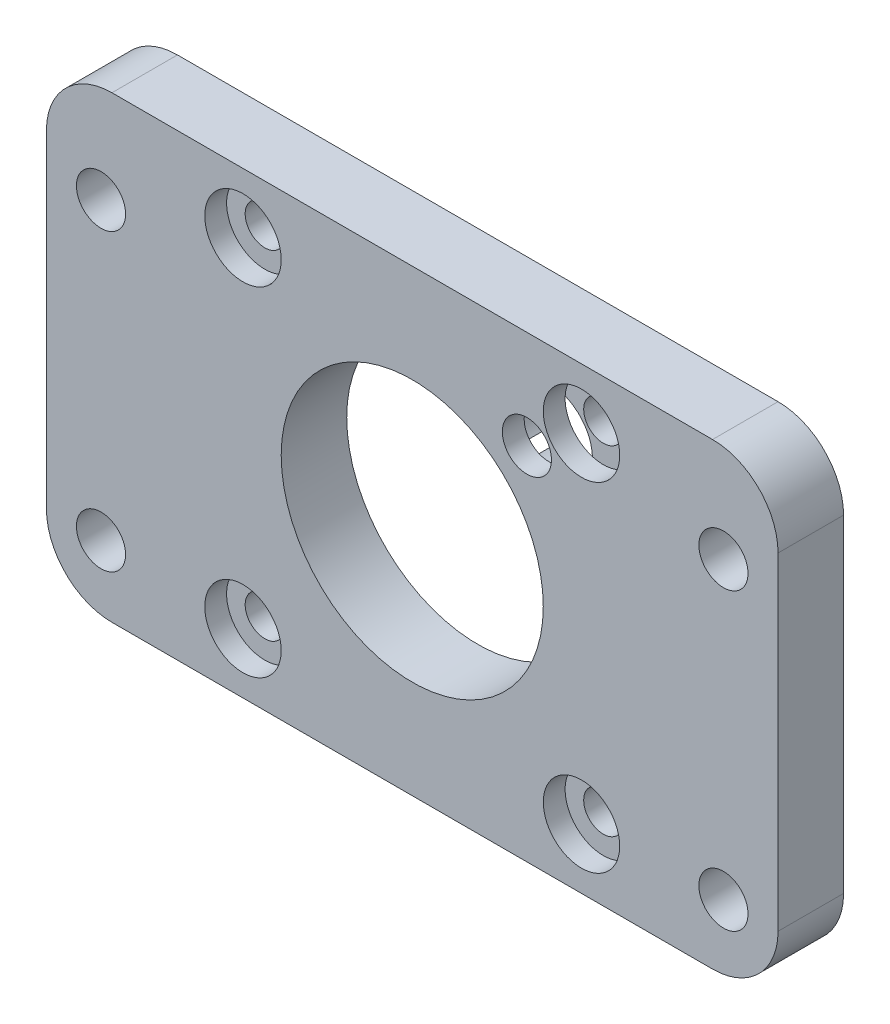
from build123d import *

# Parameters (mm, degrees)
SKETCH_1_W          = 67
SKETCH_1_H          = 42
EXTRUDE_1_DEPTH     = 6
SKETCH_2_R          = 2.25
CUT_EXTRUDE_1_DEPTH = 9
FILLET_1_R          = 6
SKETCH_3_R          = 12
SKETCH_3_R_2        = 1.8
CUT_EXTRUDE_2_DEPTH = 10
SKETCH_4_R          = 3.5
CUT_EXTRUDE_3_DEPTH = 2
SKETCH_8_R          = 4
SKETCH_8_R_2        = 2.25
CUT_EXTRUDE_6_DEPTH = 4
SKETCH_8_2_R        = 2.25
CUT_EXTRUDE_7_DEPTH = 26


with BuildPart() as part:
    # Эскиз1 → Бобышка-Вытянуть1 (new body)
    with BuildSketch(Plane.XY):
        with Locations((33.5, 21)):
            Rectangle(SKETCH_1_W, SKETCH_1_H)
    extrude(amount=EXTRUDE_1_DEPTH)

    # Эскиз2 → Вырез-Вытянуть1 (cut)
    with BuildSketch(Plane(origin=(0, 0, 0), x_dir=(-1, 0, 0), z_dir=(0, 0, -1))):
        with Locations((-62, 6)):
            Circle(SKETCH_2_R)
        with Locations((-62, 33)):
            Circle(SKETCH_2_R)
        with Locations((-5, 6)):
            Circle(SKETCH_2_R)
        with Locations((-5, 33)):
            Circle(SKETCH_2_R)
    extrude(amount=-CUT_EXTRUDE_1_DEPTH, mode=Mode.SUBTRACT)

    # Скругление1
    fillet_1_edges = [part.edges().sort_by_distance(p)[0] for p in [
        (0, 0, 3),
        (0, 42, 3),
        (67, 0, 3),
        (67, 42, 3),
    ]]
    fillet(fillet_1_edges, radius=FILLET_1_R)

    # Эскиз3 → Вырез-Вытянуть2 (cut)
    with BuildSketch(Plane(origin=(0, 0, 0), x_dir=(-1, 0, 0), z_dir=(0, 0, -1))):
        with Locations((-33.5, 21)):
            Circle(SKETCH_3_R)
        with Locations((-18, 36.5)):
            Circle(SKETCH_3_R_2)
        with Locations((-18, 5.5)):
            Circle(SKETCH_3_R_2)
        with Locations((-49, 5.5)):
            Circle(SKETCH_3_R_2)
        with Locations((-49, 36.5)):
            Circle(SKETCH_3_R_2)
    extrude(amount=-CUT_EXTRUDE_2_DEPTH, mode=Mode.SUBTRACT)

    # Эскиз4 → Вырез-Вытянуть3 (cut)
    with BuildSketch(Plane.XY.offset(6)):
        with Locations((18, 5.5)):
            Circle(SKETCH_4_R)
        with Locations((18, 36.5)):
            Circle(SKETCH_4_R)
        with Locations((49, 5.5)):
            Circle(SKETCH_4_R)
        with Locations((49, 36.5)):
            Circle(SKETCH_4_R)
    extrude(amount=-CUT_EXTRUDE_3_DEPTH, mode=Mode.SUBTRACT)

    # Эскиз8 → Вырез-Вытянуть6 (cut)
    with BuildSketch(Plane(origin=(0, 0, 0), x_dir=(-1, 0, 0), z_dir=(0, 0, -1))):
        with Locations((-44, 33)):
            Circle(SKETCH_8_R)
        with Locations((-44, 33)):
            Circle(SKETCH_8_R_2, mode=Mode.SUBTRACT)
    extrude(amount=-CUT_EXTRUDE_6_DEPTH, mode=Mode.SUBTRACT)

    # Эскиз8<2> → Вырез-Вытянуть7 (cut)
    with BuildSketch(Plane(origin=(0, 0, 0), x_dir=(-1, 0, 0), z_dir=(0, 0, -1))):
        with Locations((-44, 33)):
            Circle(SKETCH_8_2_R)
    extrude(amount=-CUT_EXTRUDE_7_DEPTH, mode=Mode.SUBTRACT)


solid = part.part
